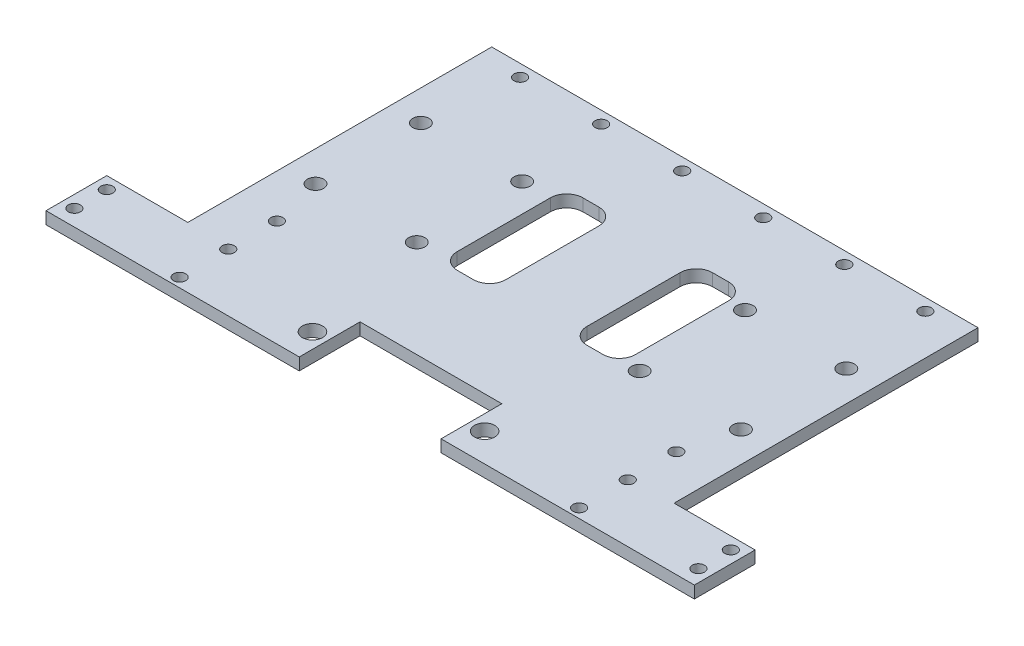
from build123d import *

# Parameters (mm, degrees)
CROQUIS1_R              = 2.5
CROQUIS1_R_2            = 2
SALIENTE_EXTRUIR1_DEPTH = 3
CROQUIS2_W              = 20
CROQUIS2_H              = 75
CORTAR_EXTRUIR1_DEPTH   = 10
CROQUIS3_W              = 35
CROQUIS3_H              = 15
CORTAR_EXTRUIR2_DEPTH   = 10
CROQUIS4_R              = 1.5
CORTAR_EXTRUIR3_DEPTH   = 10
CROQUIS5_R              = 1.5
CORTAR_EXTRUIR4_DEPTH   = 10
CORTAR_EXTRUIR5_DEPTH   = 10


with BuildPart() as part:
    # Croquis1 → Saliente-Extruir1 (new body)
    with BuildSketch(Plane(origin=(0, 0, 0), x_dir=(1, 0, 0), z_dir=(0, 1, 0))):
        with BuildLine():
            Line((-20, 0), (-140, 0))
            ThreePointArc((-140, 0), (-154.142135624, -5.857864376), (-160, -20))
            Line((-160, -20), (-160, -90))
            Line((-160, -90), (0, -90))
            Line((0, -90), (0, -20))
            ThreePointArc((0, -20), (-5.857864376, -5.857864376), (-20, 0))
        make_face()
        with Locations(Location((-101.245, -83, 0), (0, 0, 270))):
            Circle(CROQUIS1_R, mode=Mode.SUBTRACT)
        with Locations(Location((-58.755, -83, 0), (0, 0, 270))):
            Circle(CROQUIS1_R, mode=Mode.SUBTRACT)
        with Locations(Location((-132.5, -25, 0), (0, 0, 270))):
            Circle(CROQUIS1_R_2, mode=Mode.SUBTRACT)
        with Locations(Location((-107.5, -25, 0), (0, 0, 270))):
            Circle(CROQUIS1_R_2, mode=Mode.SUBTRACT)
        with Locations(Location((-107.5, -51, 0), (0, 0, 270))):
            Circle(CROQUIS1_R_2, mode=Mode.SUBTRACT)
        with Locations(Location((-132.5, -51, 0), (0, 0, 270))):
            Circle(CROQUIS1_R_2, mode=Mode.SUBTRACT)
        with Locations(Location((-52.5, -25, 0), (0, 0, 270))):
            Circle(CROQUIS1_R_2, mode=Mode.SUBTRACT)
        with Locations(Location((-27.5, -25, 0), (0, 0, 270))):
            Circle(CROQUIS1_R_2, mode=Mode.SUBTRACT)
        with Locations(Location((-52.5, -51, 0), (0, 0, 270))):
            Circle(CROQUIS1_R_2, mode=Mode.SUBTRACT)
        with Locations(Location((-27.5, -51, 0), (0, 0, 270))):
            Circle(CROQUIS1_R_2, mode=Mode.SUBTRACT)
    extrude(amount=SALIENTE_EXTRUIR1_DEPTH)

    # Croquis2 → Cortar-Extruir1 (cut)
    with BuildSketch(Plane.XZ):
        with Locations((-150, 37.5)):
            Rectangle(CROQUIS2_W, CROQUIS2_H)
        with Locations((-10, 37.5)):
            Rectangle(CROQUIS2_W, CROQUIS2_H)
    extrude(amount=-CORTAR_EXTRUIR1_DEPTH, mode=Mode.SUBTRACT)

    # Croquis3 → Cortar-Extruir2 (cut)
    with BuildSketch(Plane.XZ):
        with Locations((-80, 82.5)):
            Rectangle(CROQUIS3_W, CROQUIS3_H)
    extrude(amount=-CORTAR_EXTRUIR2_DEPTH, mode=Mode.SUBTRACT)

    # Croquis4 → Cortar-Extruir3 (cut)
    with BuildSketch(Plane(origin=(0, 3, 0), x_dir=(1, 0, 0), z_dir=(0, 1, 0))):
        with Locations(Location((-30.71, -63.73, 0), (0, 0, 270))):
            Circle(CROQUIS4_R)
        with Locations(Location((-30.71, -75.73, 0), (0, 0, 270))):
            Circle(CROQUIS4_R)
        with Locations(Location((-30.71, -87.73, 0), (0, 0, 270))):
            Circle(CROQUIS4_R)
        with Locations(Location((-129.29, -63.73, 0), (0, 0, 270))):
            Circle(CROQUIS4_R)
        with Locations(Location((-129.29, -75.73, 0), (0, 0, 270))):
            Circle(CROQUIS4_R)
        with Locations(Location((-129.29, -87.73, 0), (0, 0, 270))):
            Circle(CROQUIS4_R)
    extrude(amount=-CORTAR_EXTRUIR3_DEPTH, mode=Mode.SUBTRACT)

    # Croquis5 → Cortar-Extruir4 (cut)
    with BuildSketch(Plane.XZ):
        with Locations(Location((-130, 3, 0), (0, 0, 270))):
            Circle(CROQUIS5_R)
        with Locations(Location((-110, 3, 0), (0, 0, 270))):
            Circle(CROQUIS5_R)
        with Locations(Location((-90, 3, 0), (0, 0, 270))):
            Circle(CROQUIS5_R)
        with Locations(Location((-70, 3, 0), (0, 0, 270))):
            Circle(CROQUIS5_R)
        with Locations(Location((-50, 3, 0), (0, 0, 270))):
            Circle(CROQUIS5_R)
        with Locations(Location((-30, 3, 0), (0, 0, 270))):
            Circle(CROQUIS5_R)
        with Locations(Location((-157, 86, 0), (0, 0, 270))):
            Circle(CROQUIS5_R)
        with Locations(Location((-157, 78, 0), (0, 0, 270))):
            Circle(CROQUIS5_R)
        with Locations(Location((-3, 86, 0), (0, 0, 270))):
            Circle(CROQUIS5_R)
        with Locations(Location((-3, 78, 0), (0, 0, 270))):
            Circle(CROQUIS5_R)
    extrude(amount=-CORTAR_EXTRUIR4_DEPTH, mode=Mode.SUBTRACT)

    # Croquis6 → Cortar-Extruir5 (cut)
    with BuildSketch(Plane(origin=(0, 0, 0), x_dir=(-1, 0, 0), z_dir=(0, -1, 0))):
        with BuildLine():
            Line((64.522468013, -52), (60.522468013, -52))
            ThreePointArc((60.522468013, -52), (57.694040888, -50.828427125), (56.522468013, -48))
            Line((56.522468013, -48), (56.522468013, -25))
            ThreePointArc((56.522468013, -25), (57.694040888, -22.171572875), (60.522468013, -21))
            Line((60.522468013, -21), (64.522468013, -21))
            ThreePointArc((64.522468013, -21), (67.350895137, -22.171572875), (68.522468013, -25))
            Line((68.522468013, -25), (68.522468013, -48))
            ThreePointArc((68.522468013, -48), (67.350895137, -50.828427125), (64.522468013, -52))
        make_face()
        with BuildLine():
            Line((96.522468013, -52), (92.522468013, -52))
            ThreePointArc((92.522468013, -52), (89.694040888, -50.828427125), (88.522468013, -48))
            Line((88.522468013, -48), (88.522468013, -25))
            ThreePointArc((88.522468013, -25), (89.694040888, -22.171572875), (92.522468013, -21))
            Line((92.522468013, -21), (96.522468013, -21))
            ThreePointArc((96.522468013, -21), (99.350895137, -22.171572875), (100.522468013, -25))
            Line((100.522468013, -25), (100.522468013, -48))
            ThreePointArc((100.522468013, -48), (99.350895137, -50.828427125), (96.522468013, -52))
        make_face()
    extrude(amount=-CORTAR_EXTRUIR5_DEPTH, mode=Mode.SUBTRACT)


solid = part.part
